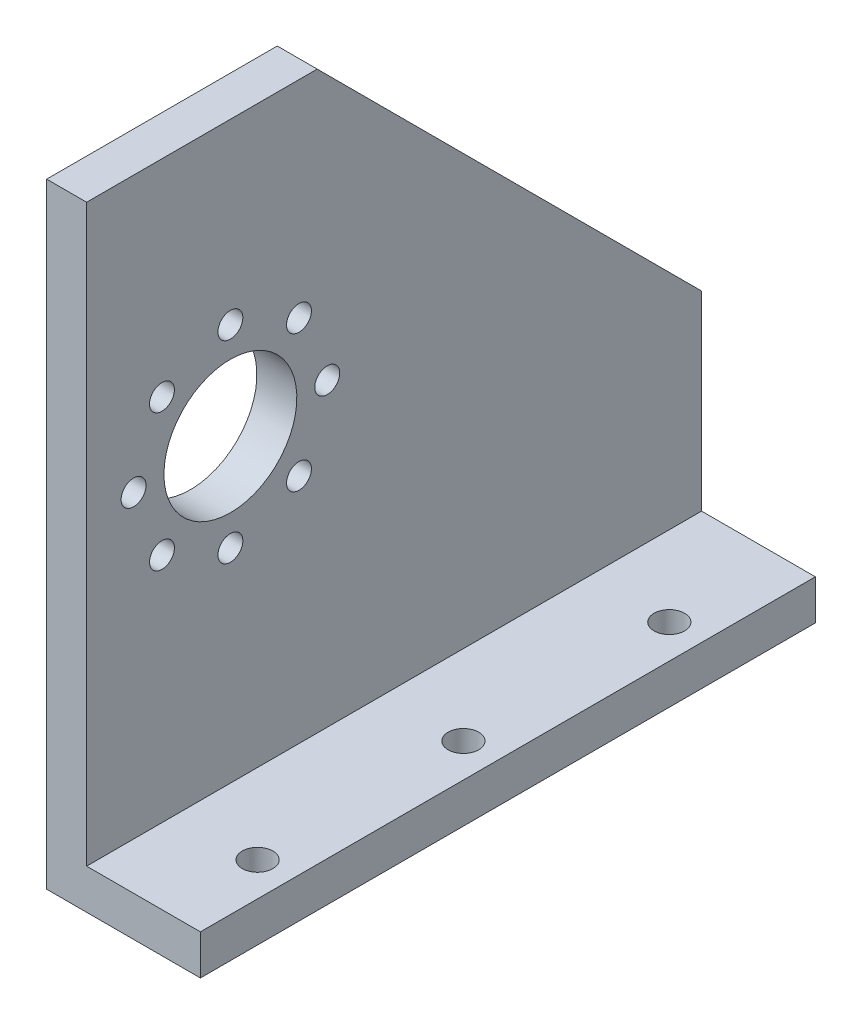
from build123d import *

# Parameters (mm, degrees)
BOSS_EXTRUDE1_DEPTH          = 50.8
F_39_0_0995_DIAMETER_HOLE1_D = 2.5273
F_46_0_081_DIAMETER_HOLE1_D  = 2.0574
SKETCH9_R                    = 5.489854512
CUT_EXTRUDE1_DEPTH           = 73.955945611


with BuildPart() as part:
    # Sketch4 → Boss-Extrude1 (new body)
    with BuildSketch(Plane.XY):
        Polygon((0, 0), (0, 50.8), (3.302, 50.8), (3.302, 3.302), (12.7, 3.302), (12.7, 0), align=None)
    extrude(amount=BOSS_EXTRUDE1_DEPTH)

    # #39 (0.0995) Diameter Hole1 (through all)
    with Locations(Plane(origin=(0, 0, 0), x_dir=(-1, 0, 0), z_dir=(0, -1, 0))):
        with Locations((-9.908705213, -43.283410028), (-9.908705213, -26.281703485), (-9.908705213, -9.270127085)):
            Hole(F_39_0_0995_DIAMETER_HOLE1_D / 2)

    # #46 (0.081) Diameter Hole1 (through all)
    with Locations(Plane.ZY):
        with Locations((38.924052109, 20.132703071), (33.256732001, 22.45014951), (30.924052109, 28.132703071), (33.256732001, 33.754608506), (38.924052109, 36.096767323), (44.576588318, 33.763667384), (46.921652769, 28.101604064), (44.576588318, 22.45014951)):
            Hole(F_46_0_081_DIAMETER_HOLE1_D / 2)

    # Sketch9 → Cut-Extrude1 (cut, through all)
    with BuildSketch(Plane.ZY):
        with Locations((38.924052109, 28.132703071)):
            Circle(SKETCH9_R)
        Polygon((0, 19.05), (31.75, 50.8), (0, 50.8), align=None)
    extrude(amount=-CUT_EXTRUDE1_DEPTH, mode=Mode.SUBTRACT)


solid = part.part
